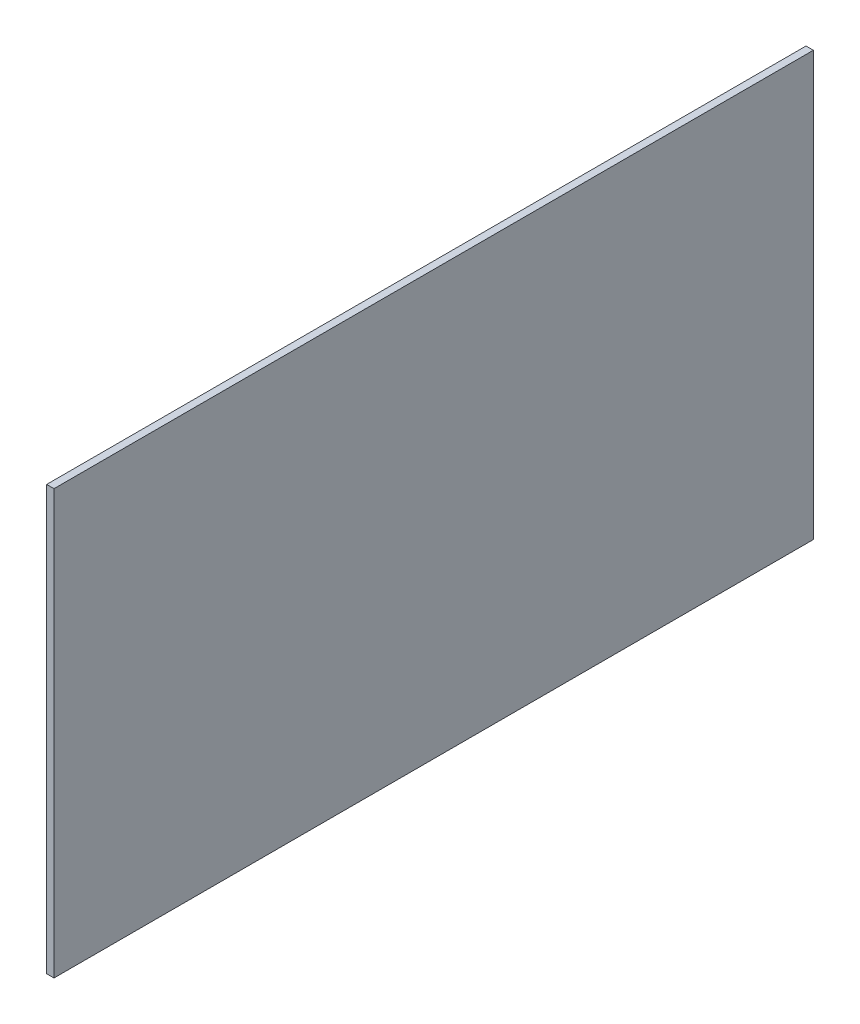
from build123d import *

# Parameters (mm, degrees)
SKETCH1_W           = 492.125
SKETCH1_H           = 274.6375
BOSS_EXTRUDE1_DEPTH = 4.7625


with BuildPart() as part:
    # Sketch1 → Boss-Extrude1 (new body)
    with BuildSketch(Plane(origin=(0, 0, 0), x_dir=(0, 0, -1), z_dir=(1, 0, 0))):
        Rectangle(SKETCH1_W, SKETCH1_H)
    extrude(amount=BOSS_EXTRUDE1_DEPTH)


solid = part.part
